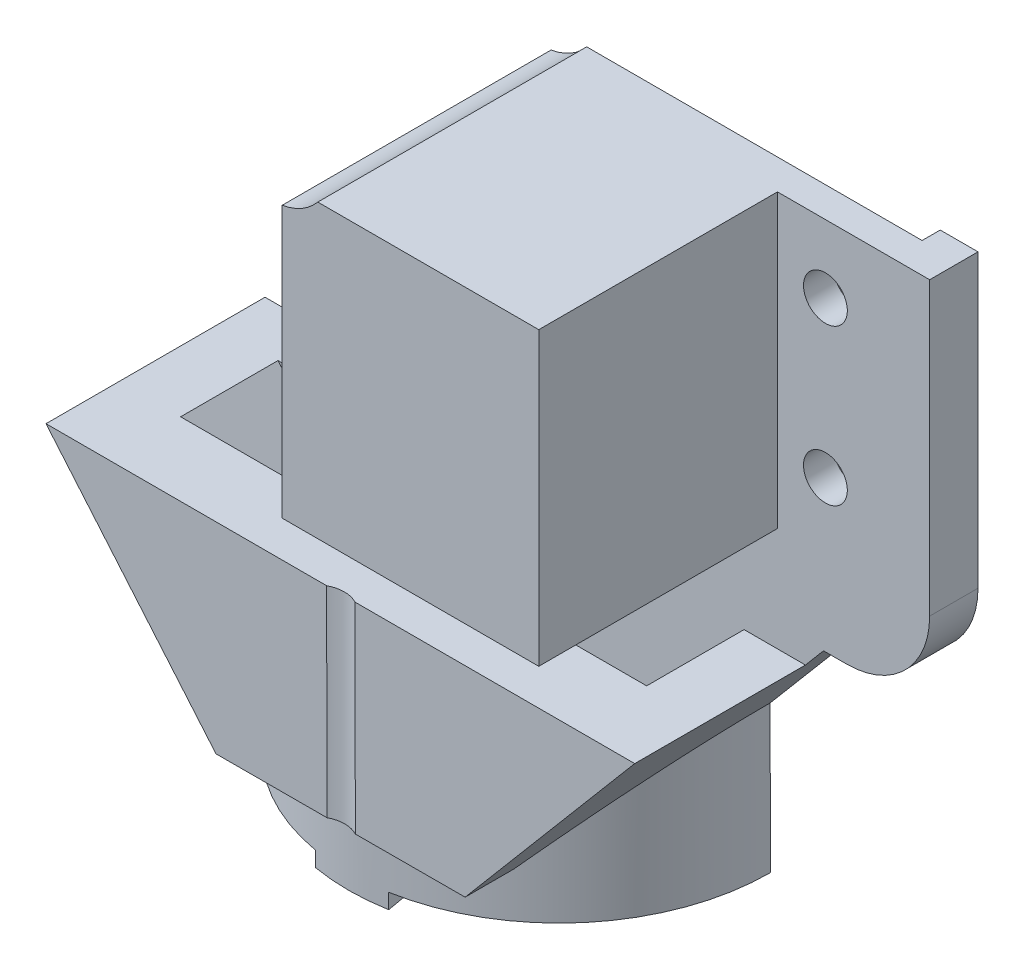
from build123d import *

# Parameters (mm, degrees)
EXTRUDE_1_DEPTH           = 14.5
EXTRUDE_2_REACH           = 54.409
CUT_EXTRUDE_2_DEPTH       = 6.5
CUT_EXTRUDE_4_DEPTH       = 1.2
CUT_EXTRUDE_5_DEPTH       = 6.45
CUT_EXTRUDE_6_REACH       = 46.446
SKETCH_12_R               = 1.45
CUT_EXTRUDE_START         = -11.3
CUT_EXTRUDE_9_DEPTH       = 11.3
CUT_EXTRUDE_10_DEPTH      = 10
CUT_EXTRUDE_10_DEPTH_BACK = 45.446455555
SKETCH_17_R               = 1.45
EXTRUDE_START             = 1
SKETCH_18_R               = 1.2
EXTRUDE_3_DEPTH           = 1
CUT_EXTRUDE_11_REACH      = 54.409
SKETCH_20_R               = 1.2
EXTRUDE_4_DEPTH           = 4.5
SKETCH_23_W               = 4
SKETCH_23_H               = 12
CUT_EXTRUDE_13_DEPTH      = 15
CUT_EXTRUDE_14_REACH      = 53.391
SKETCH_24_R               = 2


with BuildPart() as part:
    # 草圖2 → 填料-伸長1 (new body)
    with BuildSketch(Plane.XY.offset(-1.2)):
        with BuildLine():
            Line((3.005790246, 9.65), (27.71, 9.65))
            Line((27.71, 9.65), (27.71, -9.635))
            ThreePointArc((27.71, -9.635), (26.099087297, -13.524087297), (22.21, -15.135))
            Line((22.21, -15.135), (20.682621431, -15.135))
            Line((20.682621431, -15.135), (13.950432746, -23.093384504))
            Line((13.950432746, -23.093384504), (8.257610616, -29.823093007))
            Line((8.257610616, -29.823093007), (-8.232750503, -29.852481121))
            Line((-8.232750503, -29.852481121), (-13.949609825, -23.094357311))
            Line((-13.949609825, -23.094357311), (-19.48563893, -16.55))
            Line((-19.48563893, -16.55), (3.005790246, -16.55))
            Line((3.005790246, -16.55), (7.547371488, -16.55))
            Line((7.547371488, -16.55), (7.547371488, -9.65))
            Line((7.547371488, -9.65), (0.65, -9.65))
            Line((0.65, -9.65), (0.65, 8.289548141))
            ThreePointArc((0.65, 8.289548141), (1.950360965, 8.757709354), (3.005790246, 9.65))
        make_face()
    extrude(amount=EXTRUDE_1_DEPTH)

    # 草圖6 → 填料-伸長2 (add, up to next)
    with BuildSketch(Plane(origin=(0.058521361, -32.837709687, 0), x_dir=(-0.9999984119942069, -0.0017821360960036876, 0), z_dir=(0.0017821360960036876, -0.9999984119942069, 0)), mode=Mode.PRIVATE) as extrude_2_sk1:
        with BuildLine():
            Line((6.040744961, 1.2), (13.990744961, 1.2))
            ThreePointArc((13.990744961, 1.2), (0.040744961, -12.75), (-13.909255039, 1.2))
            Line((-13.909255039, 1.2), (-5.959255039, 1.2))
            ThreePointArc((-5.959255039, 1.2), (0.040744961, -4.8), (6.040744961, 1.2))
        make_face()
    extrude_2_tool1 = extrude(extrude_2_sk1.sketch, amount=-EXTRUDE_2_REACH, mode=Mode.PRIVATE) - part.part
    add(extrude_2_tool1.solids().sort_by_distance((0.017776, -32.837782, 5.486422))[0])

    # 草圖8 → 除料-伸長2 (cut)
    with BuildSketch(Plane(origin=(0.053174952, -29.837714451, 0), x_dir=(0.9999984119942069, 0.0017821360960043932, 0), z_dir=(0.0017821360960043932, -0.9999984119942069, 0))):
        with BuildLine():
            Line((5.959255039, -1.2), (-6.040744961, -1.2))
            ThreePointArc((-6.040744961, -1.2), (-0.040744961, 4.8), (5.959255039, -1.2))
        make_face()
    extrude(amount=-CUT_EXTRUDE_2_DEPTH, mode=Mode.SUBTRACT)

    # 草圖10 → 除料-伸長4 (cut)
    with BuildSketch(Plane(origin=(0, 0, -1.2), x_dir=(-1, 0, 0), z_dir=(0, 0, -1))):
        with BuildLine():
            Line((15.425245412, -16.55), (16.080147592, -16.55))
            Line((16.080147592, -16.55), (8.049473708, -26.043374829))
            ThreePointArc((8.049473708, -26.043374829), (6.88166706, -26.933100433), (5.447606932, -27.24751348))
            Line((5.447606932, -27.24751348), (-5.476193678, -27.228045749))
            ThreePointArc((-5.476193678, -27.228045749), (-6.90363194, -26.911082911), (-8.065941929, -26.023907099))
            Line((-8.065941929, -26.023907099), (-18.792755233, -13.343320029))
            ThreePointArc((-18.792755233, -13.343320029), (-19.478083321, -12.820701245), (-20.319700829, -12.635))
            Line((-20.319700829, -12.635), (-22.21, -12.635))
            ThreePointArc((-22.21, -12.635), (-24.331320344, -11.756320344), (-25.21, -9.635))
            Line((-25.21, -9.635), (-25.21, 9.756016868))
            Line((-25.21, 9.756016868), (-3.090378498, 9.756016868))
            ThreePointArc((-3.090378498, 9.756016868), (-2.008790795, 8.792133036), (-0.65, 8.289548141))
            Line((-0.65, 8.289548141), (-0.65, -9.65))
            Line((-0.65, -9.65), (-7.547371488, -9.65))
            Line((-7.547371488, -9.65), (-7.547371488, -16.55))
            Line((-7.547371488, -16.55), (15.425245412, -16.55))
        make_face()
    extrude(amount=-CUT_EXTRUDE_4_DEPTH, mode=Mode.SUBTRACT)

    # 草圖11 → 除料-伸長5 (cut)
    with BuildSketch(Plane(origin=(0, 0, 2), x_dir=(-1, 0, 0), z_dir=(0, 0, -1))):
        with BuildLine():
            Line((15.425245412, -16.55), (9.998981166, -22.964599963))
            ThreePointArc((9.998981166, -22.964599963), (9.142321056, -23.617873443), (8.090299171, -23.85))
            Line((8.090299171, -23.85), (-8.090299171, -23.85))
            ThreePointArc((-8.090299171, -23.85), (-9.142321056, -23.617873443), (-9.998981166, -22.964599963))
            Line((-9.998981166, -22.964599963), (-15.425245412, -16.55))
            Line((-15.425245412, -16.55), (15.425245412, -16.55))
        make_face()
    extrude(amount=-CUT_EXTRUDE_5_DEPTH, mode=Mode.SUBTRACT)

    # 草圖12 → 除料-伸長6 (cut, up to next)
    with BuildSketch(Plane.XY.offset(2), mode=Mode.PRIVATE) as cut_extrude_6_sk1:
        with Locations((-5.040260671, -20.109460334)):
            Circle(SKETCH_12_R)
    cut_extrude_6_tool1 = extrude(cut_extrude_6_sk1.sketch, amount=-CUT_EXTRUDE_6_REACH, mode=Mode.PRIVATE) & part.part
    # 草圖12 → 除料-伸長6 (cut, up to next)
    with BuildSketch(Plane.XY.offset(2), mode=Mode.PRIVATE) as cut_extrude_6_sk2:
        with Locations((4.959739329, -20.109460334)):
            Circle(SKETCH_12_R)
    cut_extrude_6_tool2 = extrude(cut_extrude_6_sk2.sketch, amount=-CUT_EXTRUDE_6_REACH, mode=Mode.PRIVATE) & part.part
    add(cut_extrude_6_tool1.solids().sort_by_distance((-5.040261, -20.10946, 2))[0], mode=Mode.SUBTRACT)
    add(cut_extrude_6_tool2.solids().sort_by_distance((4.959739, -20.10946, 2))[0], mode=Mode.SUBTRACT)

    # 草圖16 → 除料-伸長9 (cut)
    with BuildSketch(Plane.XY.offset(13.3).offset(CUT_EXTRUDE_START)):
        with BuildLine():
            Line((27.71, 9.65), (17.635, 9.65))
            Line((17.635, 9.65), (17.635, -9.65))
            Line((17.635, -9.65), (7.547371488, -9.65))
            Line((7.547371488, -9.65), (7.547371488, -16.55))
            Line((7.547371488, -16.55), (19.48563893, -16.55))
            Line((19.48563893, -16.55), (20.682621431, -15.135))
            Line((20.682621431, -15.135), (22.21, -15.135))
            ThreePointArc((22.21, -15.135), (26.099087297, -13.524087297), (27.71, -9.635))
            Line((27.71, -9.635), (27.71, 9.65))
        make_face()
    extrude(amount=CUT_EXTRUDE_9_DEPTH, mode=Mode.SUBTRACT)

    # 草圖17 → 除料-伸長10 (cut, two sides: drawn at the far end of the back side and taken through both)
    with BuildSketch(Plane.XY.offset(2).offset(-CUT_EXTRUDE_10_DEPTH_BACK)):
        with Locations(Location((20.81, 5.15, 0), (0, 0, 180))):
            Circle(SKETCH_17_R)
        with Locations(Location((20.81, -5.15, 0), (0, 0, 180))):
            Circle(SKETCH_17_R)
    extrude(amount=CUT_EXTRUDE_10_DEPTH + CUT_EXTRUDE_10_DEPTH_BACK, mode=Mode.SUBTRACT)

    # 草圖18 → 填料-伸長3 (add)
    with BuildSketch(Plane(origin=(0.058521361, -32.837709687, 0), x_dir=(0.9999984119942069, 0.001782136096003688, 0), z_dir=(0.001782136096003688, -0.9999984119942069, 0)).offset(EXTRUDE_START)):
        with BuildLine():
            Line((-1.542184808, 7.30666872), (-2.465462288, 12.537657948))
            ThreePointArc((-2.465462288, 12.537657948), (-0.043106116, 12.7499998), (2.379321799, 12.538477968))
            Line((2.379321799, 12.538477968), (1.457815149, 7.307176495))
            Line((1.457815149, 7.307176495), (-1.542184808, 7.30666872))
        make_face()
        with Locations((-0.042503946, 9.192304697)):
            Circle(SKETCH_18_R, mode=Mode.SUBTRACT)
    extrude(amount=-EXTRUDE_3_DEPTH)

    # 草圖20 → 除料-伸長11 (cut, up to next)
    with BuildSketch(Plane(origin=(0.058521361, -32.837709687, 0), x_dir=(0.9999984119942069, 0.001782136096003688, 0), z_dir=(0.001782136096003688, -0.9999984119942069, 0)), mode=Mode.PRIVATE) as cut_extrude_11_sk1:
        with Locations(Location((-0.042503946, 9.192304697, 0), (0, 0, 218.213041012))):
            Circle(SKETCH_20_R)
    cut_extrude_11_tool1 = extrude(cut_extrude_11_sk1.sketch, amount=-CUT_EXTRUDE_11_REACH, mode=Mode.PRIVATE) & part.part
    add(cut_extrude_11_tool1.solids().sort_by_distance((0.016017, -32.837785, 9.192305))[0], mode=Mode.SUBTRACT)

    # 草圖22 → 填料-伸長4 (add)
    with BuildSketch(Plane.XY.offset(13.3)):
        with BuildLine():
            Line((0.65, 8.289548141), (0.65, -9.65))
            Line((0.65, -9.65), (17.635, -9.65))
            Line((17.635, -9.65), (17.635, 9.65))
            Line((17.635, 9.65), (3.005790246, 9.65))
            ThreePointArc((3.005790246, 9.65), (1.950360965, 8.757709354), (0.65, 8.289548141))
        make_face()
    extrude(amount=EXTRUDE_4_DEPTH)

    # 草圖23 → 除料-伸長13 (cut)
    with BuildSketch(Plane.ZY.offset(-0.65)):
        with Locations((15, 0)):
            Rectangle(SKETCH_23_W, SKETCH_23_H)
    extrude(amount=-CUT_EXTRUDE_13_DEPTH, mode=Mode.SUBTRACT)

    # 除料-伸長14: up to this plane
    cut_extrude_14_end = Plane(origin=(3.005790246, -16.55, 13.3), z_dir=(0, -1, 0))
    # 草圖24 → 除料-伸長14 (cut, up to the surface)
    with BuildSketch(Plane(origin=(0.053174952, -29.837714451, 0), x_dir=(0.9999984119942069, 0.0017821360960043932, 0), z_dir=(0.0017821360960043932, -0.9999984119942069, 0)), mode=Mode.PRIVATE) as cut_extrude_14_sk1:
        with Locations((0, 15.066296733)):
            Circle(SKETCH_24_R)
    cut_extrude_14_tool1 = split(extrude(cut_extrude_14_sk1.sketch, amount=-CUT_EXTRUDE_14_REACH, mode=Mode.PRIVATE), bisect_by=cut_extrude_14_end, keep=Keep.BOTH, mode=Mode.PRIVATE)
    add(cut_extrude_14_tool1.solids().sort_by_distance((0.053175, -29.837714, 15.066297))[0], mode=Mode.SUBTRACT)


solid = part.part
